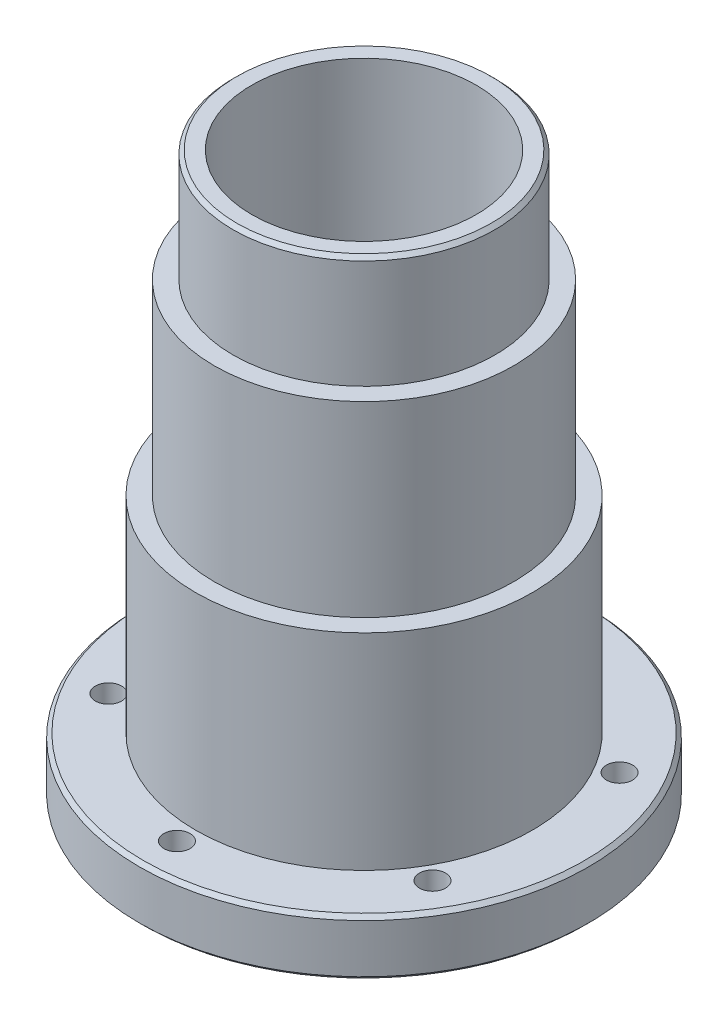
from build123d import *

# Parameters (mm, degrees)
HOLE_WIZARD_1_D           = 3.5
HOLE_WIZARD_1_CBORE_D     = 6
HOLE_WIZARD_1_CBORE_DEPTH = 4
PATTERN_CIRCULAR_1_COUNT  = 6
CHAMFER_1_SIZE            = 0.5


with BuildPart() as part:
    # 草图1 → 旋转1 (revolve)
    with BuildSketch(Plane(origin=(0, 0, 0), x_dir=(0, 0, -1), z_dir=(1, 0, 0))):
        Polygon((-15, 75), (-15, 0), (-30, 0), (-30, 7.5), (-22.5, 7.5), (-22.5, 35), (-20, 35), (-20, 60), (-17.5, 60), (-17.5, 75), align=None)
    revolve(axis=Axis((0, 44, 0), (0, -1, 0)))

    # 打孔尺寸(%根据)内六角圆柱头螺钉的类型1 (through all)
    with Locations(Plane(origin=(0, 0, 0), x_dir=(-1, 0, 0), z_dir=(0, -1, 0))):
        with Locations((0, -25)):
            hole_wizard_1 = CounterBoreHole(HOLE_WIZARD_1_D / 2, HOLE_WIZARD_1_CBORE_D / 2, HOLE_WIZARD_1_CBORE_DEPTH)

    # 阵列(圆周)1: 打孔尺寸(%根据)内六角圆柱头螺钉的类型1 ×6 about axis
    pattern_circular_1_axis = Axis((0, 0, 0), (0, 1, 0))
    for i in range(1, PATTERN_CIRCULAR_1_COUNT):
        add(hole_wizard_1.rotate(pattern_circular_1_axis, i * 360 / PATTERN_CIRCULAR_1_COUNT), mode=Mode.SUBTRACT)

    # 倒角1
    chamfer_1_edges = [part.edges().sort_by_distance(p)[0] for p in [
        (0, 7.5, -30),
        (0, 0, -30),
        (0, 75, -17.5),
    ]]
    chamfer(chamfer_1_edges, length=CHAMFER_1_SIZE)


solid = part.part
